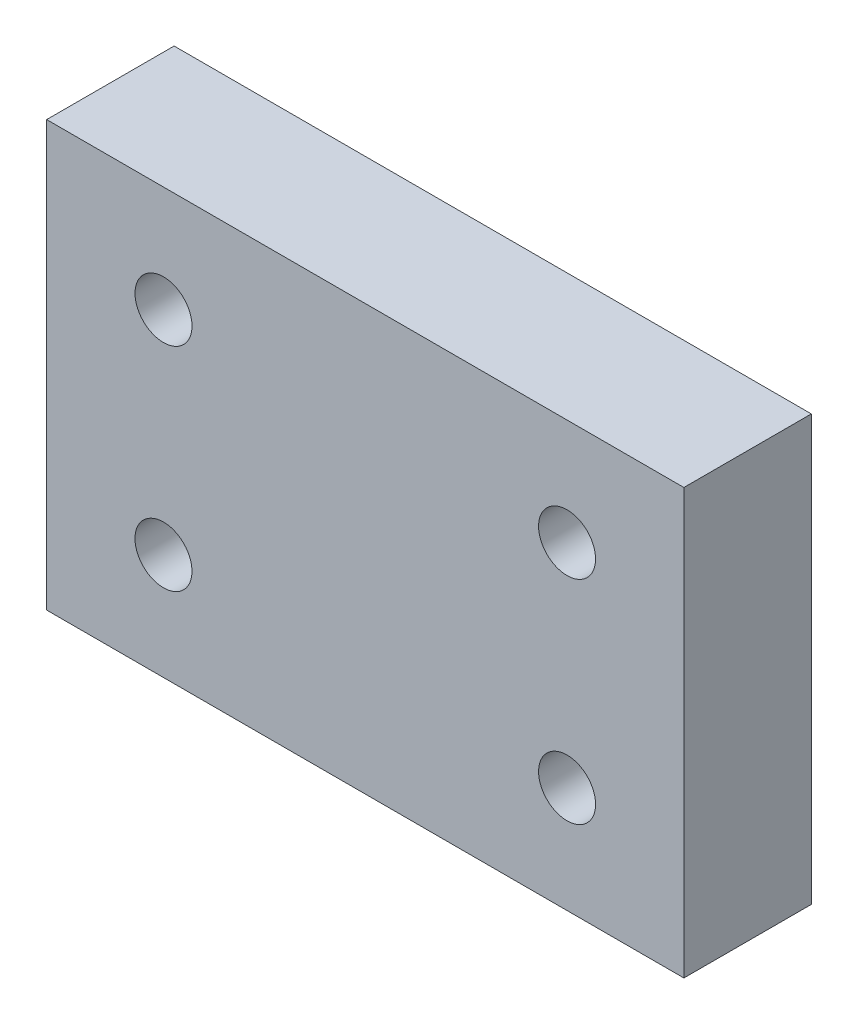
from build123d import *

# Parameters (mm, degrees)
ESQUISSE1_W        = 30
ESQUISSE1_H        = 20
ESQUISSE1_R        = 1.341808551
BOSS_EXTRU_1_DEPTH = 6


with BuildPart() as part:
    # Esquisse1 → Boss.-Extru.1 (new body)
    with BuildSketch(Plane.XY):
        with Locations((15, 10)):
            Rectangle(ESQUISSE1_W, ESQUISSE1_H)
        with Locations((5.5, 15)):
            Circle(ESQUISSE1_R, mode=Mode.SUBTRACT)
        with Locations(Location((24.5, 15, 0), (0, 0, 180))):
            Circle(ESQUISSE1_R, mode=Mode.SUBTRACT)
        with Locations((24.5, 5)):
            Circle(ESQUISSE1_R, mode=Mode.SUBTRACT)
        with Locations(Location((5.5, 5, 0), (0, 0, 180))):
            Circle(ESQUISSE1_R, mode=Mode.SUBTRACT)
    extrude(amount=BOSS_EXTRU_1_DEPTH)


solid = part.part
